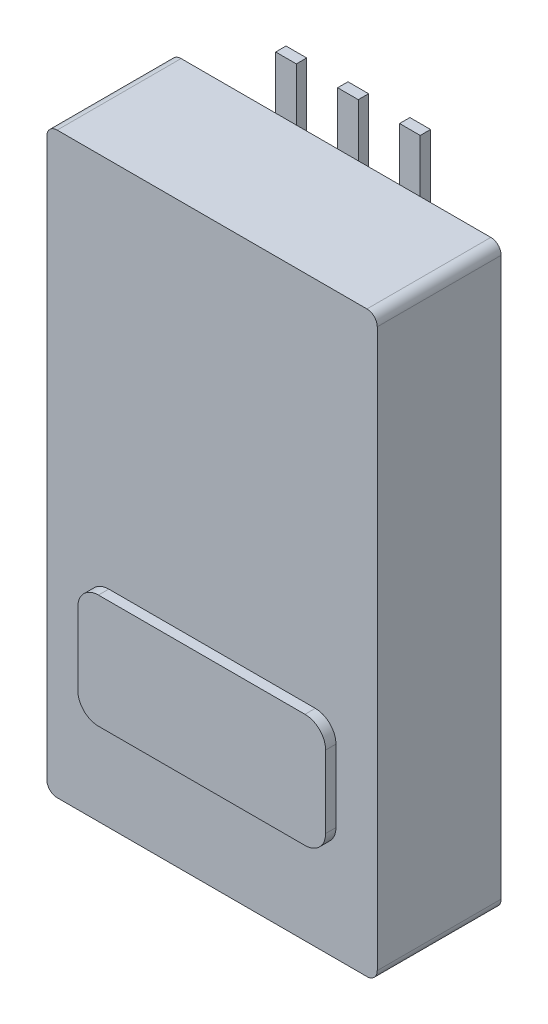
from build123d import *

# Parameters (mm, degrees)
ESQUISSE1_W        = 16
ESQUISSE1_H        = 28
BOSS_EXTRU_1_DEPTH = 6
BOSS_EXTRU_2_DEPTH = 0.5
CONG_1_R           = 0.5
ESQUISSE3_W        = 1
ESQUISSE3_H        = 4.650680728
BOSS_EXTRU_3_DEPTH = 0.5
ESQUISSE4_W        = 1
ESQUISSE4_H        = 3.990373045
BOSS_EXTRU_4_DEPTH = 0.5


with BuildPart() as part:
    # Esquisse1 → Boss.-Extru.1 (new body)
    with BuildSketch(Plane.XY):
        with Locations((2.66318356, 3.111111111)):
            Rectangle(ESQUISSE1_W, ESQUISSE1_H)
    extrude(amount=BOSS_EXTRU_1_DEPTH)

    # Esquisse2 → Boss.-Extru.2 (add)
    with BuildSketch(Plane.XY.offset(6)):
        with BuildLine():
            Line((-2.33681644, -0.888888889), (7.66318356, -0.888888889))
            ThreePointArc((7.66318356, -0.888888889), (8.370290341, -1.181782108), (8.66318356, -1.888888889))
            Line((8.66318356, -1.888888889), (8.66318356, -5.388888889))
            ThreePointArc((8.66318356, -5.388888889), (8.370290341, -6.09599567), (7.66318356, -6.388888889))
            Line((7.66318356, -6.388888889), (-2.33681644, -6.388888889))
            ThreePointArc((-2.33681644, -6.388888889), (-3.043923221, -6.09599567), (-3.33681644, -5.388888889))
            Line((-3.33681644, -5.388888889), (-3.33681644, -1.888888889))
            ThreePointArc((-3.33681644, -1.888888889), (-3.043923221, -1.181782108), (-2.33681644, -0.888888889))
        make_face()
    extrude(amount=BOSS_EXTRU_2_DEPTH)

    # Congé1
    cong_1_edges = [part.edges().sort_by_distance(p)[0] for p in [
        (-5.33681644, 17.111111111, 3),
        (10.66318356, 17.111111111, 3),
        (10.66318356, -10.888888889, 3),
        (-5.33681644, -10.888888889, 3),
    ]]
    fillet(cong_1_edges, radius=CONG_1_R)

    # Esquisse3 → Boss.-Extru.3 (add)
    with BuildSketch(Plane(origin=(0, 0, 0), x_dir=(-1, 0, 0), z_dir=(0, 0, -1))):
        with Locations((-0.244563406, 17.352420034)):
            Rectangle(ESQUISSE3_W, ESQUISSE3_H)
        with Locations((-3.244563406, 17.352420034)):
            Rectangle(ESQUISSE3_W, ESQUISSE3_H)
        with Locations((-6.244563406, 17.352420034)):
            Rectangle(ESQUISSE3_W, ESQUISSE3_H)
    extrude(amount=BOSS_EXTRU_3_DEPTH)

    # Esquisse4 → Boss.-Extru.4 (add)
    with BuildSketch(Plane(origin=(0, 0, 0), x_dir=(-1, 0, 0), z_dir=(0, 0, -1))):
        with Locations((-3.353859388, -10.762545732)):
            Rectangle(ESQUISSE4_W, ESQUISSE4_H)
    extrude(amount=BOSS_EXTRU_4_DEPTH)


solid = part.part
